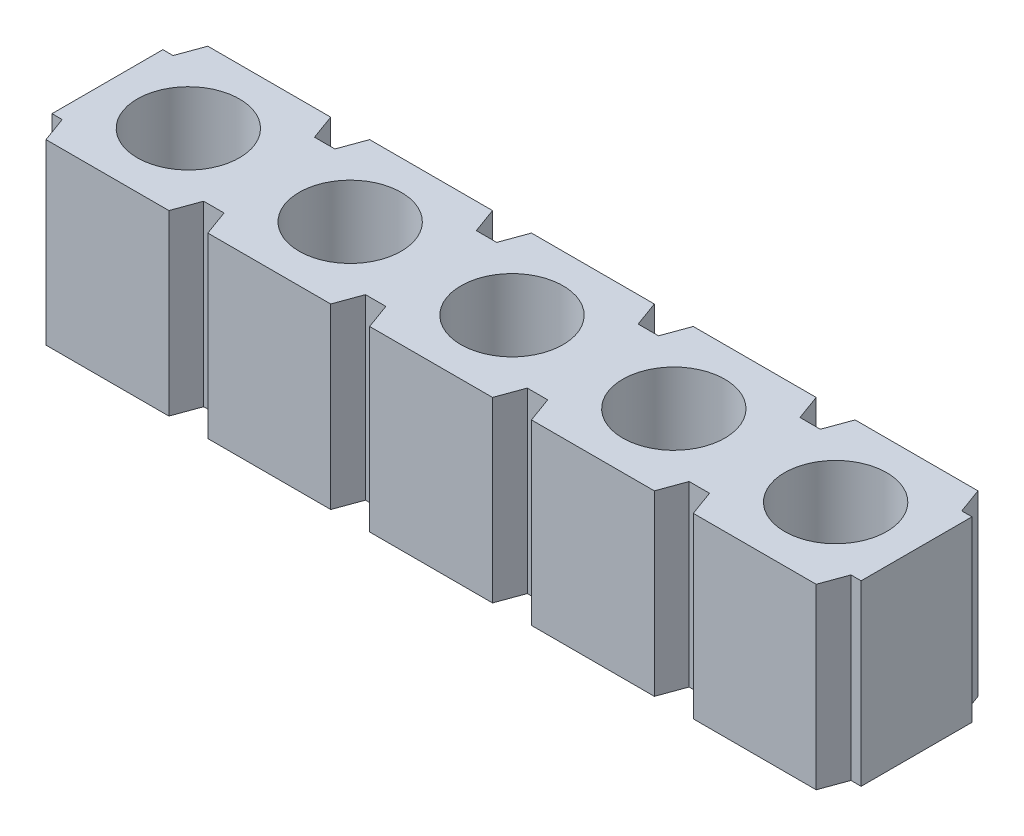
from build123d import *

# Parameters (mm, degrees)
EXTRUDE1_DEPTH  = 2.794
HOLE1_D         = 1.60274
EXTRUDE2_DEPTH  = 2.794
LPATTERN1_COUNT = 5
LPATTERN1_PITCH = 2.54
LPATTERN2_COUNT = 63
LPATTERN2_PITCH = 2.54


with BuildPart() as part:
    # Sketch1 → Extrude1 (new body)
    with BuildSketch(Plane(origin=(0, 0, 0), x_dir=(1, 0, 0), z_dir=(0, 1, 0))):
        Polygon((12.394373708, 0.40005), (12.234353708, 0.40005), (12.088747416, 0), (0, 0), (-0.145606292, 0.40005), (-0.305626292, 0.40005), (-0.305626292, 2.13995), (-0.145606292, 2.13995), (0, 2.54), (12.088747416, 2.54), (12.234353708, 2.13995), (12.394373708, 2.13995), align=None)
    extrude(amount=-EXTRUDE1_DEPTH)

    # Hole1 (through all)
    with Locations(Plane(origin=(0.964373708, 0, -1.27), x_dir=(0, 0, 1), z_dir=(0, 1, 0))):
        with Locations((0, 0)):
            hole1 = Hole(HOLE1_D / 2)

    # Sketch4 → Extrude2 (cut)
    with BuildSketch(Plane(origin=(0, 0, 0), x_dir=(1, 0, 0), z_dir=(0, 1, 0))):
        Polygon((1.928772816, 0), (2.5399746, 0), (2.394368308, 0.40005), (2.074379108, 0.40005), align=None)
        Polygon((2.074379108, 2.13995), (2.394368308, 2.13995), (2.5399746, 2.54), (1.928772816, 2.54), align=None)
    extrude2 = extrude(amount=-EXTRUDE2_DEPTH, mode=Mode.SUBTRACT)

    # LPattern1: Hole1 ×5
    with Locations(*[(i * LPATTERN1_PITCH, 0, 0) for i in range(1, LPATTERN1_COUNT)]):
        add(hole1, mode=Mode.SUBTRACT)

    # LPattern2: Extrude2 ×63
    with Locations(*[(i * LPATTERN2_PITCH, 0, 0) for i in range(1, LPATTERN2_COUNT)]):
        add(extrude2, mode=Mode.SUBTRACT)


solid = part.part
